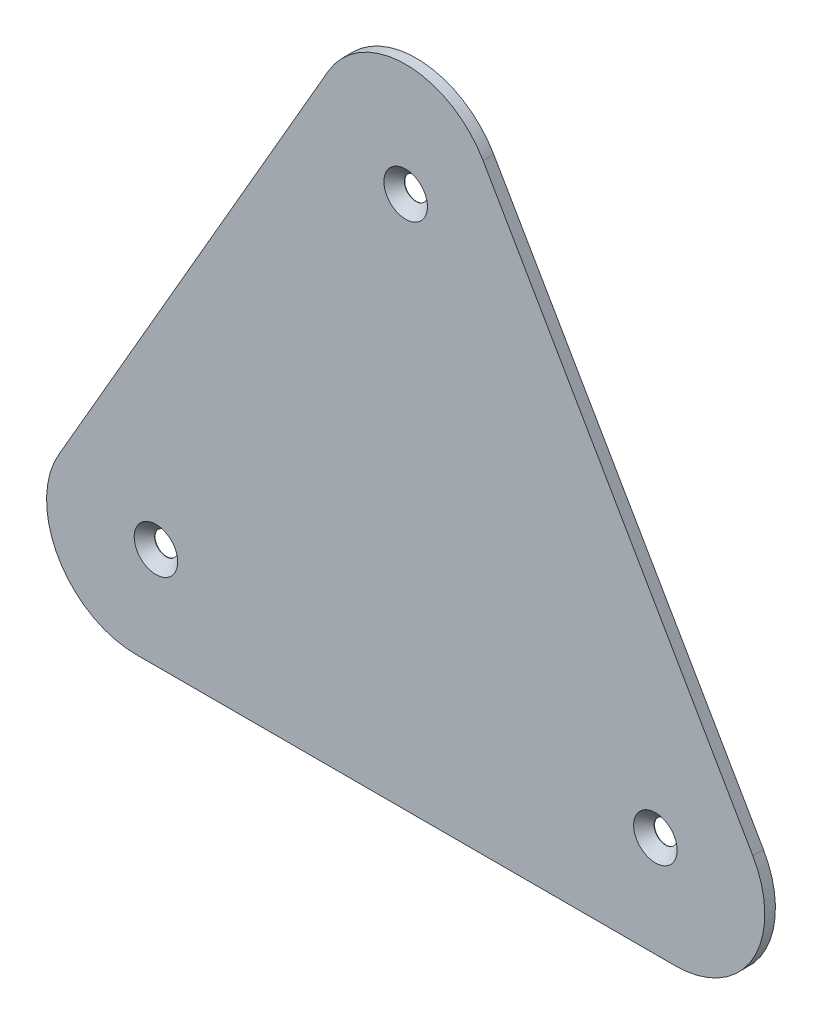
from build123d import *

# Parameters (mm, degrees)
BOSS_EXTRUDE1_DEPTH                           = 5.08
CSK_FOR_M10_FLAT_HEAD_MACHINE_SCREW1_AT_COUNT = 2
CSK_FOR_M10_FLAT_HEAD_MACHINE_SCREW1_AT_PITCH = 238.125
CSK_FOR_M10_FLAT_HEAD_MACHINE_SCREW1_2_COUNT  = 2
CSK_FOR_M10_FLAT_HEAD_MACHINE_SCREW1_2_PITCH  = 238.125


with BuildPart() as part:
    # Sketch1 → Boss-Extrude1 (new body)
    with BuildSketch(Plane.XY):
        with BuildLine():
            Line((-128.5875, -116.86748613), (128.5875, -116.86748613))
            ThreePointArc((128.5875, -116.86748613), (165.503961865, -95.553756935), (165.503961865, -52.926298544))
            Line((165.503961865, -52.926298544), (36.916461865, 169.793784674))
            ThreePointArc((36.916461865, 169.793784674), (0, 191.10751387), (-36.916461865, 169.793784674))
            Line((-36.916461865, 169.793784674), (-165.503961865, -52.926298544))
            ThreePointArc((-165.503961865, -52.926298544), (-165.503961865, -95.553756935), (-128.5875, -116.86748613))
        make_face()
    extrude(amount=BOSS_EXTRUDE1_DEPTH)

    # Sketch3 → CSK for M10 Flat Head Machine Screw1 (revolve, cut)
    with BuildSketch(Plane(origin=(0, 137.481532851, 5.08), x_dir=(0, -1, 0), z_dir=(1, 0, 0))):
        Polygon((0, 0), (0, 5.08), (5.5, 5.08), (5.5, 4.881), (10.381, 0), align=None)
    csk_for_m10_flat_head_machine_screw1 = revolve(axis=Axis((0, 137.481532851, 11.43), (0, 0, -1)), mode=Mode.SUBTRACT)

    # CSK for M10 Flat Head Machine Screw1 at: CSK for M10 Flat Head Machine Screw1 ×2
    with Locations(*[Vector(-0.5, -0.8660254037844387, 0) * (i * CSK_FOR_M10_FLAT_HEAD_MACHINE_SCREW1_AT_PITCH) for i in range(1, CSK_FOR_M10_FLAT_HEAD_MACHINE_SCREW1_AT_COUNT)]):
        add(csk_for_m10_flat_head_machine_screw1, mode=Mode.SUBTRACT)

    # CSK for M10 Flat Head Machine Screw1 2: CSK for M10 Flat Head Machine Screw1 ×2
    with Locations(*[Vector(0.5, -0.8660254037844387, 0) * (i * CSK_FOR_M10_FLAT_HEAD_MACHINE_SCREW1_2_PITCH) for i in range(1, CSK_FOR_M10_FLAT_HEAD_MACHINE_SCREW1_2_COUNT)]):
        add(csk_for_m10_flat_head_machine_screw1, mode=Mode.SUBTRACT)


solid = part.part
